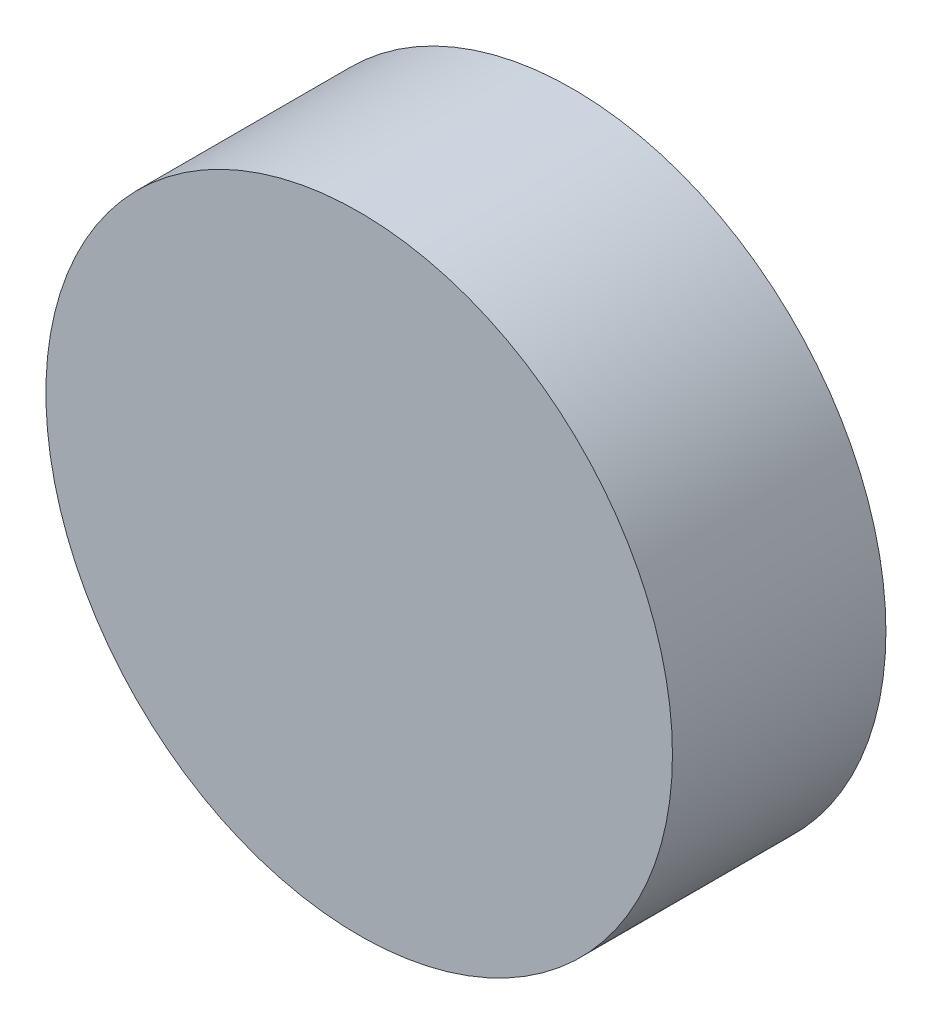
from build123d import *

# Parameters (mm, degrees)
SKETCH_3_R      = 29.350657221
EXTRUDE_1_DEPTH = 20


with BuildPart() as part:
    # 草图3 → 凸台-拉伸1 (new body)
    with BuildSketch(Plane.XY):
        Circle(SKETCH_3_R)
    extrude(amount=EXTRUDE_1_DEPTH)


solid = part.part
